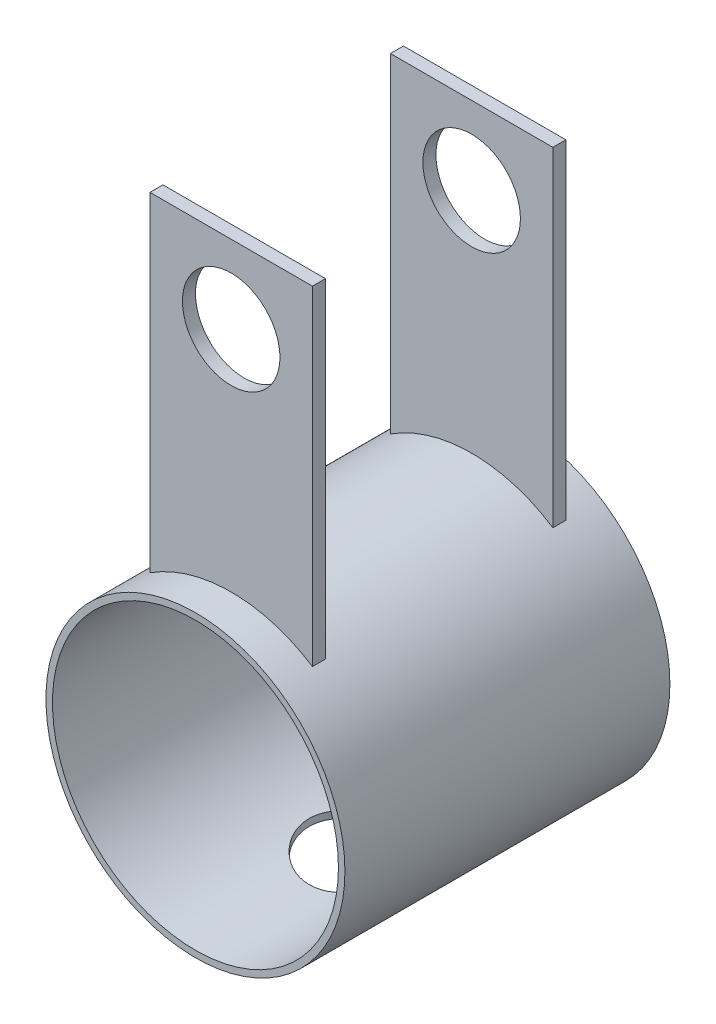
from build123d import *

# Parameters (mm, degrees)
ESBO_O1_R                = 23
ESBO_O1_R_2              = 22
RESSALTO_EXTRUS_O1_DEPTH = 50
ESBO_O2_R                = 7.5
CORTE_EXTRUS_O1_DEPTH    = 50
RESSALTO_EXTRUS_O2_DEPTH = 70
ESBO_O4_R                = 22
CORTE_EXTRUS_O2_DEPTH    = 70
ESBO_O7_R                = 7.5
CORTE_EXTRUS_O4_DEPTH    = 70


with BuildPart() as part:
    # Esboço1 → Ressalto-extrusão1 (new body)
    with BuildSketch(Plane.XY):
        Circle(ESBO_O1_R)
        Circle(ESBO_O1_R_2, mode=Mode.SUBTRACT)
    extrude(amount=RESSALTO_EXTRUS_O1_DEPTH)

    # Esboço2 → Corte-extrusão1 (cut)
    with BuildSketch(Plane(origin=(0, 0, 0), x_dir=(1, 0, 0), z_dir=(0, 1, 0))):
        with Locations(Location((0, -25, 0), (0, 0, 270))):
            Circle(ESBO_O2_R)
    extrude(amount=-CORTE_EXTRUS_O1_DEPTH, mode=Mode.SUBTRACT)

    # Esboço3 → Ressalto-extrusão2 (add)
    with BuildSketch(Plane(origin=(0, 0, 0), x_dir=(1, 0, 0), z_dir=(0, 1, 0))):
        Polygon((0, -7.5), (-12.5, -7.5), (-12.5, -5.5), (12.5, -5.5), (12.5, -7.5), align=None)
        Polygon((0, -42.5), (-12.5, -42.5), (-12.5, -44.5), (12.5, -44.5), (12.5, -42.5), align=None)
    extrude(amount=RESSALTO_EXTRUS_O2_DEPTH)

    # Esboço4 → Corte-extrusão2 (cut)
    with BuildSketch(Plane(origin=(0, 0, 5.5), x_dir=(-1, 0, 0), z_dir=(0, 0, -1))):
        with Locations(Location((0, 0, 0), (0, 0, 180))):
            Circle(ESBO_O4_R)
    extrude(amount=-CORTE_EXTRUS_O2_DEPTH, mode=Mode.SUBTRACT)

    # Esboço7 → Corte-extrusão4 (cut)
    with BuildSketch(Plane(origin=(0, 0, 5.5), x_dir=(-1, 0, 0), z_dir=(0, 0, -1))):
        with Locations((0, 58)):
            Circle(ESBO_O7_R)
    extrude(amount=-CORTE_EXTRUS_O4_DEPTH, mode=Mode.SUBTRACT)


solid = part.part
